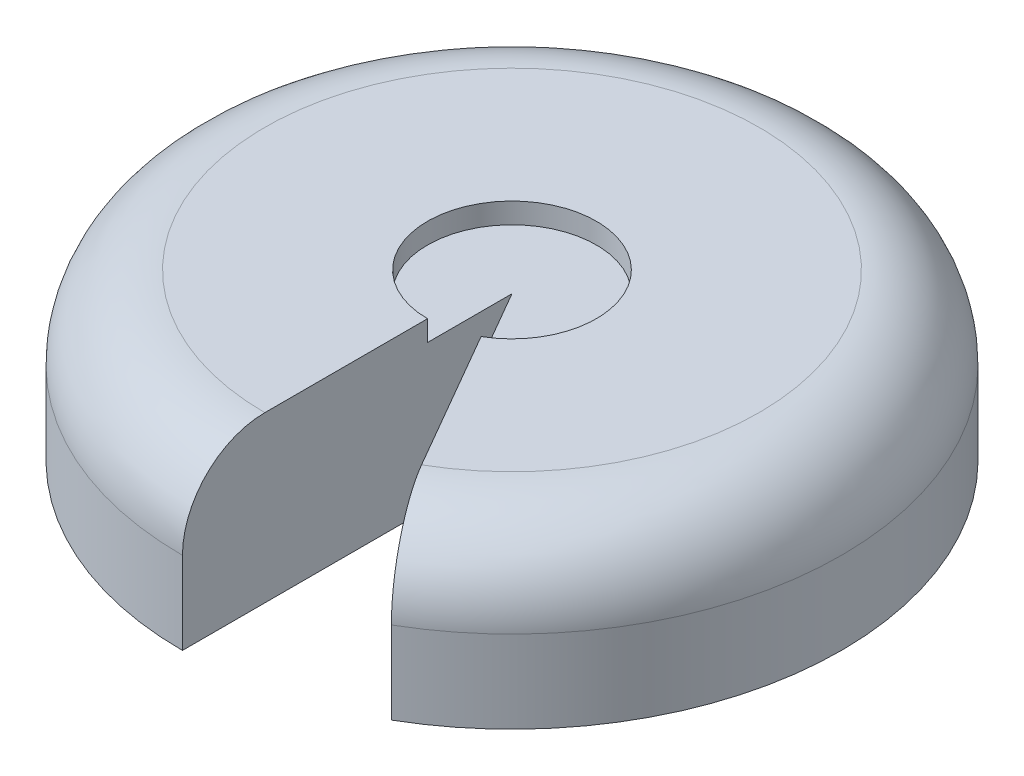
from build123d import *

# Parameters (mm, degrees)
BOSS_EXTRUDE1_DEPTH = 20
SKETCH3_R           = 10.25
CUT_EXTRUDE1_DEPTH  = 2.5
FILLET1_R           = 10


with BuildPart() as part:
    # Sketch1 → Boss-Extrude1 (new body)
    with BuildSketch(Plane(origin=(0, 0, 0), x_dir=(1, 0, 0), z_dir=(0, 1, 0))):
        with BuildLine():
            Line((0, -40), (0, 0))
            Line((0, 0), (20, -34.641016151))
            ThreePointArc((20, -34.641016151), (34.641016151, -20), (40, 0))
            ThreePointArc((40, 0), (-28.284271247, 28.284271247), (0, -40))
        make_face()
    extrude(amount=BOSS_EXTRUDE1_DEPTH)

    # Sketch3 → Cut-Extrude1 (cut)
    with BuildSketch(Plane(origin=(0, 20, 0), x_dir=(1, 0, 0), z_dir=(0, 1, 0))):
        Circle(SKETCH3_R)
    extrude(amount=-CUT_EXTRUDE1_DEPTH, mode=Mode.SUBTRACT)

    # Fillet1
    fillet1_edges = [part.edges().sort_by_distance(p)[0] for p in [
        (-10.352761804, 20, -38.637033052),
    ]]
    fillet(fillet1_edges, radius=FILLET1_R)


solid = part.part
